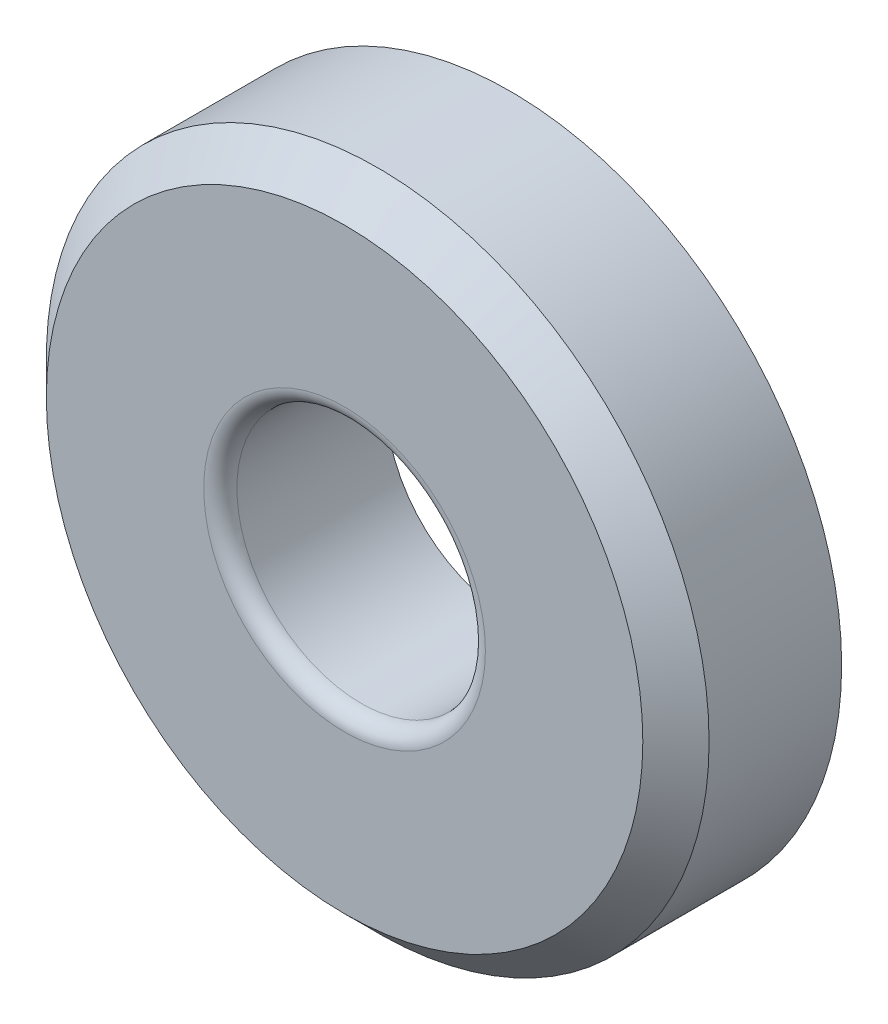
from build123d import *

# Parameters (mm, degrees)
SKETCH2_R           = 25.4
SKETCH2_R_2         = 9.525
BOSS_EXTRUDE1_DEPTH = 12.7
CHAMFER1_SIZE       = 2.54
FILLET1_R           = 1.27


with BuildPart() as part:
    # Sketch2 → Boss-Extrude1 (new body)
    with BuildSketch(Plane.XY):
        Circle(SKETCH2_R)
        Circle(SKETCH2_R_2, mode=Mode.SUBTRACT)
    extrude(amount=BOSS_EXTRUDE1_DEPTH)

    # Chamfer1
    chamfer1_edges = [part.edges().sort_by_distance(p)[0] for p in [
        (-25.4, 0, 12.7),
    ]]
    chamfer(chamfer1_edges, length=CHAMFER1_SIZE)

    # Fillet1
    fillet1_edges = [part.edges().sort_by_distance(p)[0] for p in [
        (-9.525, 0, 12.7),
    ]]
    fillet(fillet1_edges, radius=FILLET1_R)


solid = part.part
